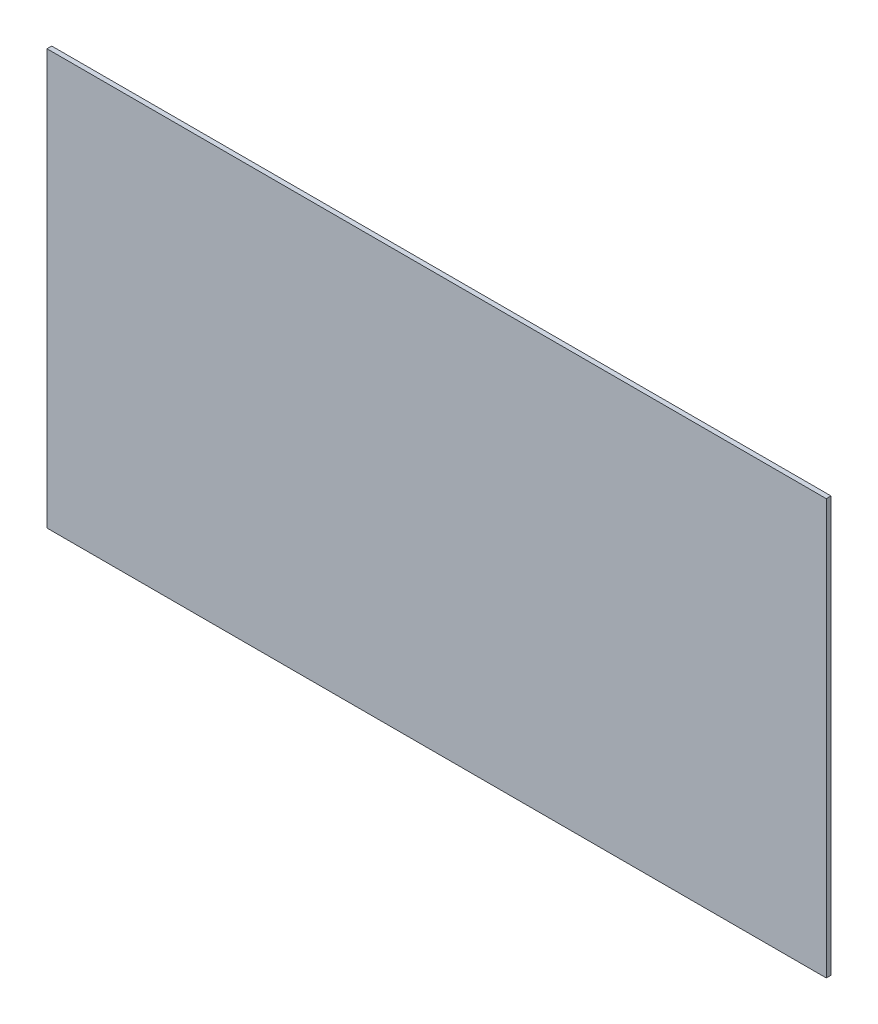
from build123d import *

# Parameters (mm, degrees)
SKETCH1_W           = 524.51
SKETCH1_H           = 279.4
BOSS_EXTRUDE2_DEPTH = 3.18516


with BuildPart() as part:
    # Sketch1 → Boss-Extrude2 (new body)
    with BuildSketch(Plane.XY):
        with Locations((262.255, 139.7)):
            Rectangle(SKETCH1_W, SKETCH1_H)
    extrude(amount=BOSS_EXTRUDE2_DEPTH)


solid = part.part
